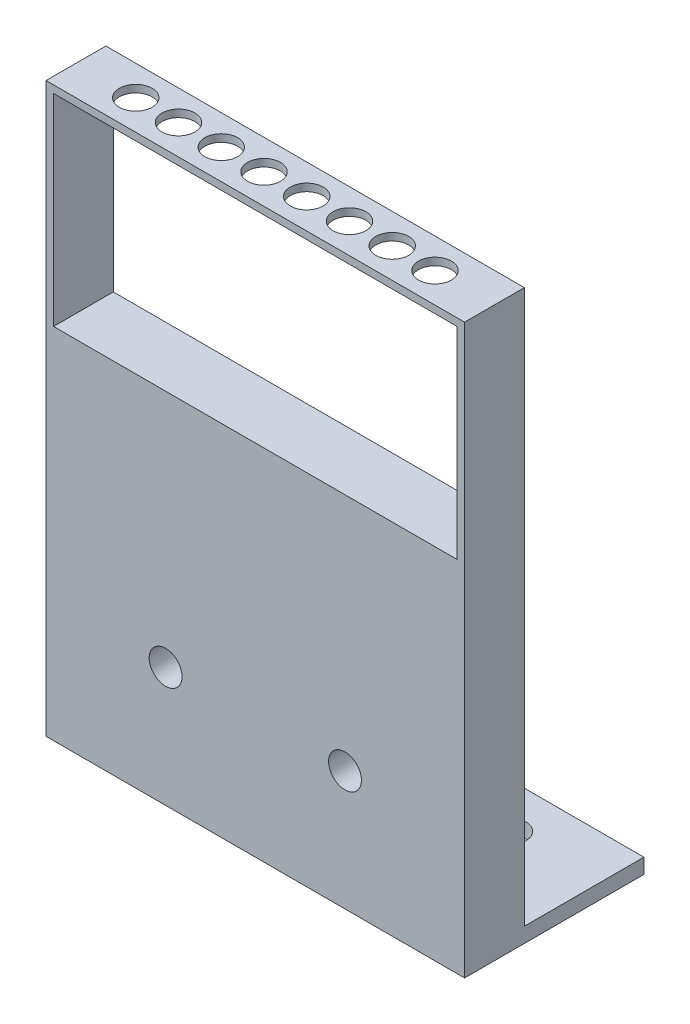
from build123d import *

# Parameters (mm, degrees)
SKETCH1_W               = 88.9
SKETCH1_H               = 12.7
BOSS_EXTRUDE1_DEPTH     = 76.2
SKETCH2_R               = 3.4925
BOSS_EXTRUDE4_DEPTH     = 3.175
BOSS_EXTRUDE5_DEPTH     = 12.7
CUT_EXTRUDE1_REACH      = 134.44
SKETCH4_R               = 3.4925
CUT_EXTRUDE2_DEPTH      = 133.439750453
CUT_EXTRUDE2_DEPTH_BACK = 133.439750453
SKETCH5_R               = 3.4925


with BuildPart() as part:
    # Sketch1 → Boss-Extrude1 (new body)
    with BuildSketch(Plane(origin=(0, 0, 0), x_dir=(1, 0, 0), z_dir=(0, 1, 0))):
        Rectangle(SKETCH1_W, SKETCH1_H)
    extrude(amount=BOSS_EXTRUDE1_DEPTH)

    # Sketch2 → Boss-Extrude4 (add)
    with BuildSketch(Plane(origin=(0, 0, 0), x_dir=(1, 0, 0), z_dir=(0, 1, 0))):
        Polygon((-44.45, 22.225), (-44.45, 6.35), (44.45, 6.35), (44.45, 31.75), (-44.45, 31.75), align=None)
        with Locations(Location((-25.4, 22.225, 0), (0, 0, 270))):
            Circle(SKETCH2_R, mode=Mode.SUBTRACT)
        with Locations(Location((0, 22.225, 0), (0, 0, 270))):
            Circle(SKETCH2_R, mode=Mode.SUBTRACT)
        with Locations(Location((25.4, 22.225, 0), (0, 0, 270))):
            Circle(SKETCH2_R, mode=Mode.SUBTRACT)
    extrude(amount=BOSS_EXTRUDE4_DEPTH)

    # Sketch3 → Boss-Extrude5 (add)
    with BuildSketch(Plane.XY.offset(6.35)):
        Polygon((-44.45, 76.2), (-44.45, 120.65), (44.45, 120.65), (44.45, 76.2), (42.8625, 76.2), (42.8625, 119.0625), (-42.8625, 119.0625), (-42.8625, 76.2), align=None)
    extrude(amount=-BOSS_EXTRUDE5_DEPTH)

    # Sketch4 → Cut-Extrude1 (cut, up to next)
    with BuildSketch(Plane(origin=(0, 120.65, 0), x_dir=(1, 0, 0), z_dir=(0, 1, 0)), mode=Mode.PRIVATE) as cut_extrude1_sk1:
        with Locations(Location((-31.75, 0, 0), (0, 0, 270))):
            Circle(SKETCH4_R)
    cut_extrude1_tool1 = extrude(cut_extrude1_sk1.sketch, amount=-CUT_EXTRUDE1_REACH, mode=Mode.PRIVATE) & part.part
    # Sketch4 → Cut-Extrude1 (cut, up to next)
    with BuildSketch(Plane(origin=(0, 120.65, 0), x_dir=(1, 0, 0), z_dir=(0, 1, 0)), mode=Mode.PRIVATE) as cut_extrude1_sk2:
        with Locations(Location((-22.6695, 0, 0), (0, 0, 270))):
            Circle(SKETCH4_R)
    cut_extrude1_tool2 = extrude(cut_extrude1_sk2.sketch, amount=-CUT_EXTRUDE1_REACH, mode=Mode.PRIVATE) & part.part
    # Sketch4 → Cut-Extrude1 (cut, up to next)
    with BuildSketch(Plane(origin=(0, 120.65, 0), x_dir=(1, 0, 0), z_dir=(0, 1, 0)), mode=Mode.PRIVATE) as cut_extrude1_sk3:
        with Locations(Location((-13.589, 0, 0), (0, 0, 270))):
            Circle(SKETCH4_R)
    cut_extrude1_tool3 = extrude(cut_extrude1_sk3.sketch, amount=-CUT_EXTRUDE1_REACH, mode=Mode.PRIVATE) & part.part
    # Sketch4 → Cut-Extrude1 (cut, up to next)
    with BuildSketch(Plane(origin=(0, 120.65, 0), x_dir=(1, 0, 0), z_dir=(0, 1, 0)), mode=Mode.PRIVATE) as cut_extrude1_sk4:
        with Locations(Location((-4.5085, 0, 0), (0, 0, 270))):
            Circle(SKETCH4_R)
    cut_extrude1_tool4 = extrude(cut_extrude1_sk4.sketch, amount=-CUT_EXTRUDE1_REACH, mode=Mode.PRIVATE) & part.part
    # Sketch4 → Cut-Extrude1 (cut, up to next)
    with BuildSketch(Plane(origin=(0, 120.65, 0), x_dir=(1, 0, 0), z_dir=(0, 1, 0)), mode=Mode.PRIVATE) as cut_extrude1_sk5:
        with Locations(Location((4.572, 0, 0), (0, 0, 270))):
            Circle(SKETCH4_R)
    cut_extrude1_tool5 = extrude(cut_extrude1_sk5.sketch, amount=-CUT_EXTRUDE1_REACH, mode=Mode.PRIVATE) & part.part
    # Sketch4 → Cut-Extrude1 (cut, up to next)
    with BuildSketch(Plane(origin=(0, 120.65, 0), x_dir=(1, 0, 0), z_dir=(0, 1, 0)), mode=Mode.PRIVATE) as cut_extrude1_sk6:
        with Locations(Location((13.6525, 0, 0), (0, 0, 270))):
            Circle(SKETCH4_R)
    cut_extrude1_tool6 = extrude(cut_extrude1_sk6.sketch, amount=-CUT_EXTRUDE1_REACH, mode=Mode.PRIVATE) & part.part
    # Sketch4 → Cut-Extrude1 (cut, up to next)
    with BuildSketch(Plane(origin=(0, 120.65, 0), x_dir=(1, 0, 0), z_dir=(0, 1, 0)), mode=Mode.PRIVATE) as cut_extrude1_sk7:
        with Locations(Location((22.733, 0, 0), (0, 0, 270))):
            Circle(SKETCH4_R)
    cut_extrude1_tool7 = extrude(cut_extrude1_sk7.sketch, amount=-CUT_EXTRUDE1_REACH, mode=Mode.PRIVATE) & part.part
    # Sketch4 → Cut-Extrude1 (cut, up to next)
    with BuildSketch(Plane(origin=(0, 120.65, 0), x_dir=(1, 0, 0), z_dir=(0, 1, 0)), mode=Mode.PRIVATE) as cut_extrude1_sk8:
        with Locations(Location((31.8135, 0, 0), (0, 0, 270))):
            Circle(SKETCH4_R)
    cut_extrude1_tool8 = extrude(cut_extrude1_sk8.sketch, amount=-CUT_EXTRUDE1_REACH, mode=Mode.PRIVATE) & part.part
    add(cut_extrude1_tool1.solids().sort_by_distance((-31.75, 120.65, 0))[0], mode=Mode.SUBTRACT)
    add(cut_extrude1_tool2.solids().sort_by_distance((-22.6695, 120.65, 0))[0], mode=Mode.SUBTRACT)
    add(cut_extrude1_tool3.solids().sort_by_distance((-13.589, 120.65, 0))[0], mode=Mode.SUBTRACT)
    add(cut_extrude1_tool4.solids().sort_by_distance((-4.5085, 120.65, 0))[0], mode=Mode.SUBTRACT)
    add(cut_extrude1_tool5.solids().sort_by_distance((4.572, 120.65, 0))[0], mode=Mode.SUBTRACT)
    add(cut_extrude1_tool6.solids().sort_by_distance((13.6525, 120.65, 0))[0], mode=Mode.SUBTRACT)
    add(cut_extrude1_tool7.solids().sort_by_distance((22.733, 120.65, 0))[0], mode=Mode.SUBTRACT)
    add(cut_extrude1_tool8.solids().sort_by_distance((31.8135, 120.65, 0))[0], mode=Mode.SUBTRACT)

    # Sketch5 → Cut-Extrude2 (cut, two sides: drawn at the far end of the back side and taken through both)
    with BuildSketch(Plane.XY.offset(-CUT_EXTRUDE2_DEPTH_BACK)):
        with Locations((-19.05, 25.4)):
            Circle(SKETCH5_R)
        with Locations((19.05, 25.4)):
            Circle(SKETCH5_R)
    extrude(amount=CUT_EXTRUDE2_DEPTH + CUT_EXTRUDE2_DEPTH_BACK, mode=Mode.SUBTRACT)


solid = part.part
